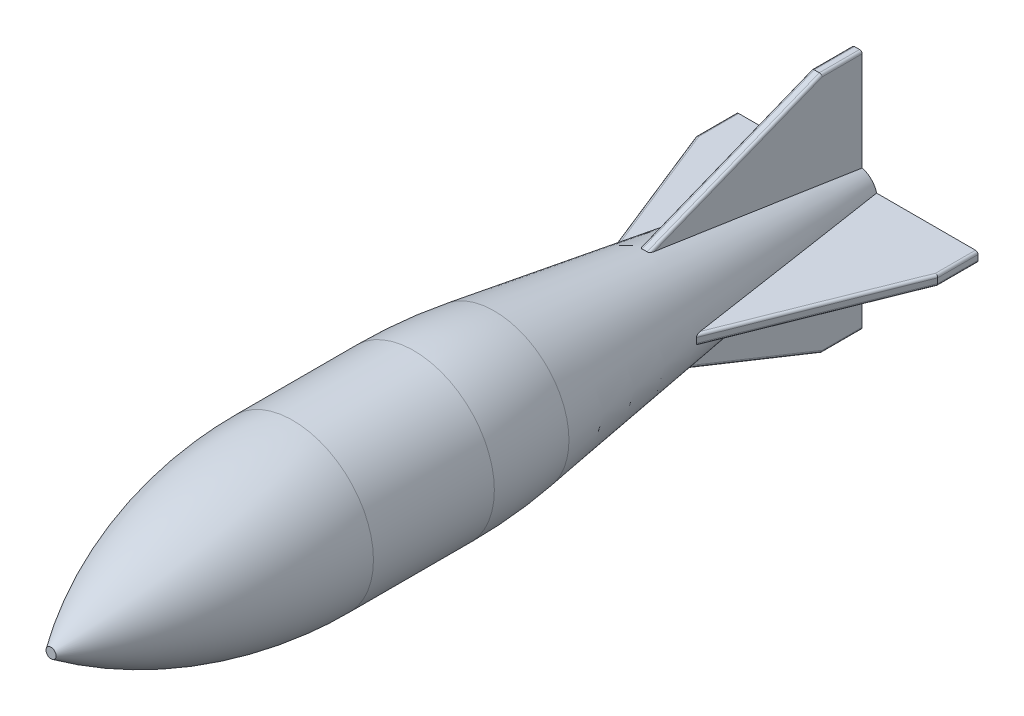
from build123d import *

# Parameters (mm, degrees)
BOSS_EXTRUDE2_DEPTH      = 0.79375
FILLET2_R                = 0.396875
CIRPATTERN5_COUNT        = 4
FILLET2_OF_CIRPATTERN5_R = 0.396875


with BuildPart() as part:
    # Sketch3 → Revolve2 (revolve)
    with BuildSketch(Plane(origin=(0, 0, 0), x_dir=(0, 0, -1), z_dir=(1, 0, 0)), mode=Mode.PRIVATE) as revolve2_sk:
        with BuildLine():
            Line((0, 0.79375), (0, 0))
            Line((0, 0), (127, 0))
            Line((127, 0), (127, 3.175))
            Line((127, 3.175), (69.85, 11.752276451))
            ThreePointArc((69.85, 11.752276451), (63.517656161, 12.462740177), (57.15, 12.7))
            Line((57.15, 12.7), (38.1, 12.7))
            ThreePointArc((38.1, 12.7), (18.1414881, 9.65411308), (0, 0.79375))
        make_face()
    revolve(revolve2_sk.sketch.rotate(Axis((0, 0, 0), (0, 0, -1)), 90), axis=Axis((0, 0, 0), (0, 0, -1)))

    # Sketch5 → Boss-Extrude2 (add, symmetric)
    with BuildSketch(Plane(origin=(0, 0, 0), x_dir=(0, 0, -1), z_dir=(1, 0, 0))):
        Polygon((120.65, 19.05), (127, 19.05), (127, 0), (88.9, 6.35), align=None)
    boss_extrude2 = extrude(amount=BOSS_EXTRUDE2_DEPTH, both=True)

    # Fillet2
    fillet2_edges = [part.edges().sort_by_distance(p)[0] for p in [
        (-0.79375, 19.05, -123.825),
        (0.79375, 19.05, -123.825),
        (-0.79375, 13.61067, -107.051675),
        (0.79375, 13.61067, -107.051675),
    ]]
    fillet(fillet2_edges, radius=FILLET2_R)

    # CirPattern5: Boss-Extrude2 ×4 about axis
    cirpattern5_axis = Axis((0, 0, 0), (0, 0, 1))
    for i in range(1, CIRPATTERN5_COUNT):
        add(boss_extrude2.rotate(cirpattern5_axis, i * 360 / CIRPATTERN5_COUNT))

    # Fillet2 of CirPattern5
    fillet2_of_cirpattern5_edges = [part.edges().sort_by_distance(p)[0] for p in [
        (-19.05, -0.79375, -123.825),
        (-19.05, 0.79375, -123.825),
        (-13.61067, -0.79375, -107.051675),
        (-13.61067, 0.79375, -107.051675),
        (0.79375, -19.05, -123.825),
        (-0.79375, -19.05, -123.825),
        (0.79375, -13.61067, -107.051675),
        (-0.79375, -13.61067, -107.051675),
        (19.05, 0.79375, -123.825),
        (19.05, -0.79375, -123.825),
        (13.61067, 0.79375, -107.051675),
        (13.61067, -0.79375, -107.051675),
    ]]
    fillet(fillet2_of_cirpattern5_edges, radius=FILLET2_OF_CIRPATTERN5_R)


solid = part.part
